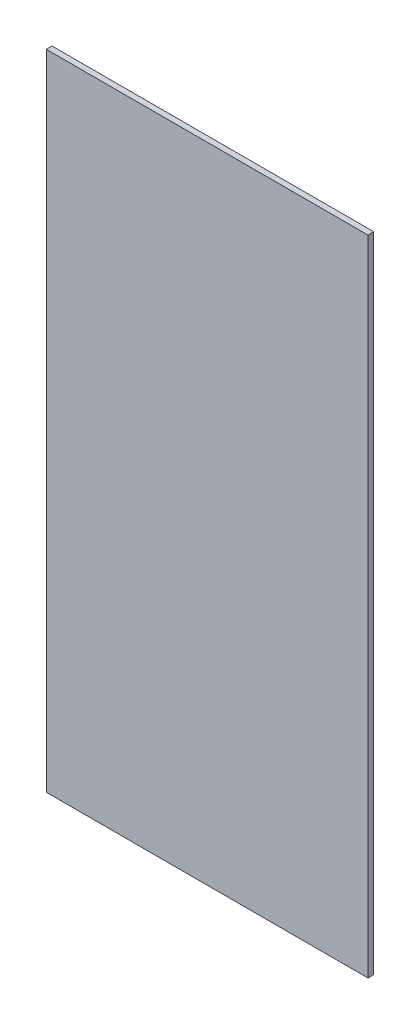
from build123d import *

# Parameters (mm, degrees)
SKETCH1_W           = 177.8
SKETCH1_H           = 355.6
BOSS_EXTRUDE1_DEPTH = 3.175


with BuildPart() as part:
    # Sketch1 → Boss-Extrude1 (new body)
    with BuildSketch(Plane.XY):
        Rectangle(SKETCH1_W, SKETCH1_H)
    extrude(amount=BOSS_EXTRUDE1_DEPTH)


solid = part.part
